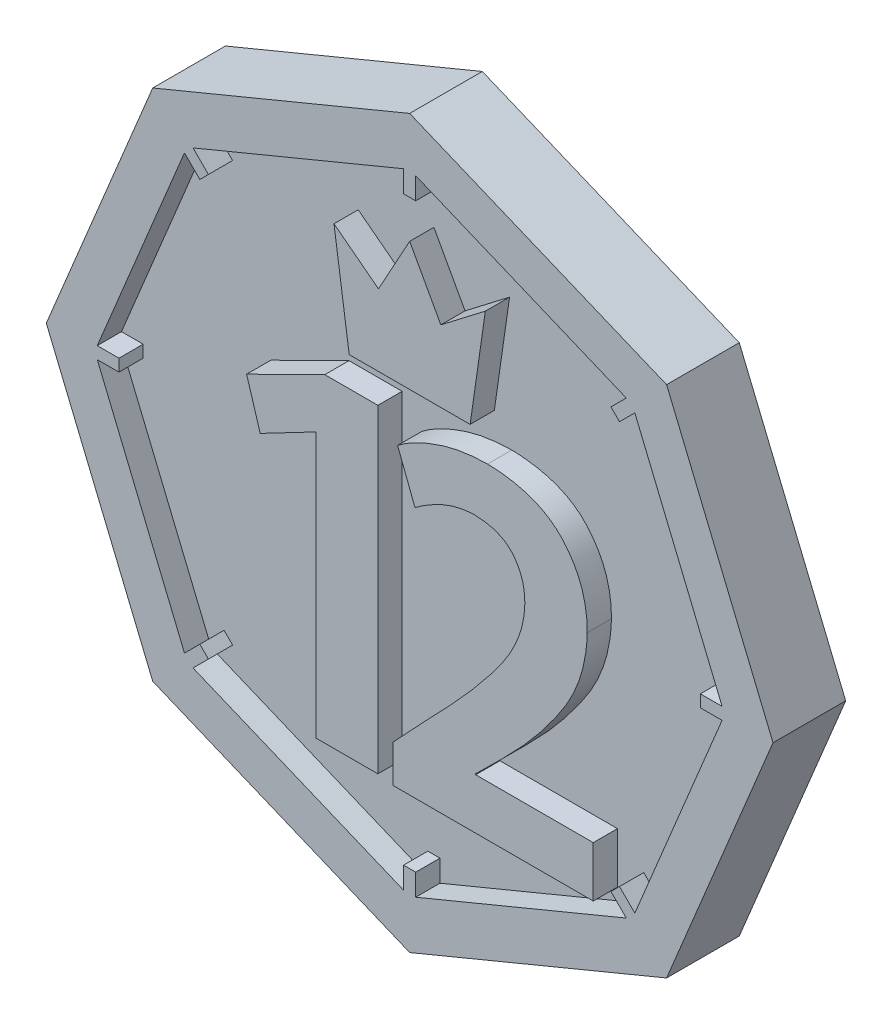
from build123d import *

# Parameters (mm, degrees)
BOSS_EXTRUDE2_DEPTH      = 2.54
BOSS_EXTRUDE3_DEPTH      = 5.08
BOSS_EXTRUDE3_DEPTH_BACK = 2.54
SKETCH2_W                = 1.27
SKETCH2_H                = 2.54
SKETCH2_W_2              = 2.54
SKETCH2_H_2              = 1.27
BOSS_EXTRUDE4_DEPTH      = 2.54
SKETCH4_W                = 46.629356418
SKETCH4_H                = 1.27
SKETCH4_W_2              = 1.27
SKETCH4_H_2              = 2.54
SKETCH4_W_3              = 2.54
BOSS_EXTRUDE5_DEPTH      = 1.27


with BuildPart() as part:
    # Sketch1 → Boss-Extrude2 (new body)
    with BuildSketch(Plane.XY):
        Polygon((33.02, 0), (23.348665915, 23.348665915), (0, 33.02), (-23.348665915, 23.348665915), (-33.02, 0), (-23.348665915, -23.348665915), (0, -33.02), (23.348665915, -23.348665915), align=None)
    extrude(amount=BOSS_EXTRUDE2_DEPTH)

    # Sketch1<3> → Boss-Extrude3 (add, two sides: drawn at the far end of the back side and taken through both)
    with BuildSketch(Plane.XY.offset(-BOSS_EXTRUDE3_DEPTH_BACK)):
        Polygon((-26.940768363, -26.940768363), (0, -38.1), (26.940768363, -26.940768363), (38.1, 0), (26.940768363, 26.940768363), (0, 38.1), (-26.940768363, 26.940768363), (-38.1, 0), align=None)
        Polygon((33.02, 0), (23.348665915, 23.348665915), (0, 33.02), (-23.348665915, 23.348665915), (-33.02, 0), (-23.348665915, -23.348665915), (0, -33.02), (23.348665915, -23.348665915), align=None, mode=Mode.SUBTRACT)
    extrude(amount=BOSS_EXTRUDE3_DEPTH + BOSS_EXTRUDE3_DEPTH_BACK)

    # Sketch2 → Boss-Extrude4 (add)
    with BuildSketch(Plane.XY.offset(2.54)):
        Polygon((-6.33928366, 13.03071018), (6.33928366, 13.03071018), (7.934955593, 24.113005041), (3.268356916, 20.533769163), (0, 26.484800243), (-3.268356916, 20.533769163), (-7.934955593, 24.113005041), align=None)
        Polygon((-23.797678721, -22.899653109), (-22.001627497, -21.103601885), (-21.103601885, -22.001627497), (-22.899653109, -23.797678721), align=None)
        with Locations((0, -31.75)):
            Rectangle(SKETCH2_W, SKETCH2_H)
        with Locations((-31.75, 0)):
            Rectangle(SKETCH2_W_2, SKETCH2_H_2)
        Polygon((-22.899653109, 23.797678721), (-21.103601885, 22.001627497), (-22.001627497, 21.103601885), (-23.797678721, 22.899653109), align=None)
        with Locations((0, 31.75)):
            Rectangle(SKETCH2_W, SKETCH2_H)
        Polygon((23.797678721, 22.899653109), (22.001627497, 21.103601885), (21.103601885, 22.001627497), (22.899653109, 23.797678721), align=None)
        with Locations((31.75, 0)):
            Rectangle(SKETCH2_W_2, SKETCH2_H_2)
        Polygon((22.899653109, -23.797678721), (21.103601885, -22.001627497), (22.001627497, -21.103601885), (23.797678721, -22.899653109), align=None)
        Polygon((-3.333537811, 9.927966113), (-8.900177124, 9.927966113), (-17.096018601, 5.871617863), (-15.671940782, 1.205489471), (-9.886624643, 4.231654837), (-9.797619779, 4.231654837), (-9.797619779, -23.537862633), (-3.333537811, -23.537862633), align=None)
        with BuildLine():
            Line((6.922689554, -18.493218361), (6.922689554, -18.403697928))
            Line((6.922689554, -18.403697928), (9.72634276, -15.628564506))
            add(Edge.make_bspline(
                [(9.72634276, -15.628564506), (10.332287944, -15.016473056), (11.524647172, -13.812019406), (13.172416474, -11.931158207), (14.660164159, -10.024941525), (15.798717524, -8.421067286), (16.598893506, -7.111608304), (17.116956203, -6.113359897), (17.560916159, -5.098439509), (17.930397338, -4.064084728), (18.220945847, -3.011778524), (18.433320957, -1.940167738), (18.570651911, -0.849044229), (18.603408202, -0.114308088), (18.619881518, 0.255194677)],
                knots=[0, 0, 0, 0, 1.659202022, 3.264923779, 4.814209511, 6.316896139, 7.051567576, 7.769144172, 8.482047353, 9.1843673, 9.883576409, 10.583408793, 11.287588645, 12, 12, 12, 12], degree=3))
            add(Edge.make_bspline(
                [(18.619881518, 0.255194677), (18.615435576, 0.601071076), (18.60668269, 1.282010333), (18.485887622, 2.281152902), (18.294922803, 3.240615682), (18.019974847, 4.156272636), (17.65383247, 5.024856703), (17.216597259, 5.851719306), (16.696514323, 6.636264444), (16.100524071, 7.376309607), (15.420064426, 8.058628564), (14.638104606, 8.644389658), (13.776230121, 9.15234777), (12.820652179, 9.56242342), (11.780481809, 9.889480517), (10.653245374, 10.131514076), (9.439093712, 10.295910385), (8.598098517, 10.327665773), (8.164035785, 10.344055677)],
                knots=[0, 0, 0, 0, 1.009543328, 1.987524111, 2.933968874, 3.863854154, 4.774078899, 5.682489326, 6.591612952, 7.518557726, 8.453666412, 9.397555261, 10.363899254, 11.368743061, 12.427215963, 13.543452787, 14.732102632, 16, 16, 16, 16], degree=3))
            add(Edge.make_bspline(
                [(8.164035785, 10.344055677), (7.684941919, 10.32797453), (6.743007697, 10.296357797), (5.362015599, 10.120943659), (4.041603429, 9.838122373), (2.794317739, 9.44973706), (1.626243466, 8.996697362), (0.559580653, 8.486492932), (-0.412669652, 7.947709555), (-0.988773246, 7.523656862), (-1.268115692, 7.31804121)],
                knots=[0, 0, 0, 0, 1.142131743, 2.245516072, 3.313064714, 4.356728811, 5.356075675, 6.296497493, 7.174001758, 8, 8, 8, 8], degree=3))
            Line((-1.268115692, 7.31804121), (0.5588418, 2.588843604))
            add(Edge.make_bspline(
                [(0.5588418, 2.588843604), (0.761624414, 2.73822703), (1.179666998, 3.046185549), (1.852748741, 3.473980759), (2.585276418, 3.878915966), (3.359619649, 4.265740791), (4.179369339, 4.595766629), (5.034966611, 4.842117606), (5.922117143, 5.001085019), (6.525905075, 5.030455546), (6.831301754, 5.045311195)],
                knots=[0, 0, 0, 0, 0.882381775, 1.819057125, 2.791981266, 3.814391476, 4.850565017, 5.88354078, 6.929492323, 8, 8, 8, 8], degree=3))
            add(Edge.make_bspline(
                [(6.831301754, 5.045311195), (7.05262941, 5.035997075), (7.481773548, 5.017937426), (8.102028287, 4.933140782), (8.675924907, 4.806874673), (9.20569981, 4.632281868), (9.687862888, 4.408049058), (10.124128937, 4.137236311), (10.508288932, 3.815406522), (10.962276839, 3.336981143), (11.414642606, 2.641825328), (11.816627167, 1.722978765), (12.043877023, 0.703922747), (12.066720546, -0.003373605), (12.078539606, -0.369323202)],
                knots=[0, 0, 0, 0, 0.93230204, 1.807690748, 2.631964675, 3.403485345, 4.151360469, 4.865902888, 5.558923755, 6.255646087, 7.636553115, 9.02477282, 10.460640741, 12, 12, 12, 12], degree=3))
            add(Edge.make_bspline(
                [(12.078539606, -0.369323202), (12.066738561, -0.650949198), (12.042933032, -1.219056121), (11.907439467, -2.071709448), (11.703715377, -2.935234471), (11.400711398, -3.804157577), (11.027577521, -4.686470876), (10.575049654, -5.577903391), (10.036648395, -6.475155054), (9.413096647, -7.383813144), (8.715042663, -8.315131115), (7.950934713, -9.282038165), (7.128727973, -10.294348765), (6.231878122, -11.342562384), (5.268348446, -12.430888512), (4.226503403, -13.548859259), (3.128783816, -14.715233752), (2.366408777, -15.498360209), (1.976801949, -15.898571914)],
                knots=[0, 0, 0, 0, 0.714042855, 1.440395043, 2.184640807, 2.96058558, 3.769988571, 4.611854656, 5.492656414, 6.420700846, 7.404361908, 8.442699269, 9.544774642, 10.710251598, 11.939640591, 13.229377797, 14.584091463, 16, 16, 16, 16], degree=3))
            Line((1.976801949, -15.898571914), (-1.755284656, -19.873409916))
            Line((-1.755284656, -19.873409916), (-1.755284656, -23.798401171))
            Line((-1.755284656, -23.798401171), (19.249347605, -23.798401171))
            Line((19.249347605, -23.798401171), (19.249347605, -18.493218361))
            Line((19.249347605, -18.493218361), (6.922689554, -18.493218361))
        make_face()
    extrude(amount=BOSS_EXTRUDE4_DEPTH)

    # Sketch4 → Boss-Extrude5 (add)
    # profile 1 of 22: a face of its own
    with BuildSketch(Plane(origin=(0, 0, 0), x_dir=(-1, 0, 0), z_dir=(0, 0, -1))):
        with Locations((0, 16.421907481)):
            Rectangle(SKETCH4_W, SKETCH4_H)
    # profile 2 of 22: a face of its own
    with BuildSketch(Plane(origin=(0, 0, 0), x_dir=(-1, 0, 0), z_dir=(0, 0, -1))):
        with Locations((0, -7.79874833)):
            Rectangle(SKETCH4_W, SKETCH4_H)
    # profile 3 of 22: a face of its own
    with BuildSketch(Plane(origin=(0, 0, 0), x_dir=(-1, 0, 0), z_dir=(0, 0, -1))):
        Polygon((-4.468926018, 18.824161798), (4.468926018, 18.824161798), (5.630987553, 27.738580238), (2.060469106, 23.703632944), (0, 27.682107512), (-2.060469106, 23.703632944), (-5.630987553, 27.738580238), align=None)
    # profile 4 of 22: a face of its own
    with BuildSketch(Plane(origin=(0, 0, 0), x_dir=(-1, 0, 0), z_dir=(0, 0, -1))):
        with Locations((0, -31.75)):
            Rectangle(SKETCH4_W_2, SKETCH4_H_2)
    # profile 5 of 22: a face of its own
    with BuildSketch(Plane(origin=(0, 0, 0), x_dir=(-1, 0, 0), z_dir=(0, 0, -1))):
        Polygon((-23.797678721, -22.899653109), (-22.001627497, -21.103601885), (-21.103601885, -22.001627497), (-22.899653109, -23.797678721), align=None)
    # profile 6 of 22: a face of its own
    with BuildSketch(Plane(origin=(0, 0, 0), x_dir=(-1, 0, 0), z_dir=(0, 0, -1))):
        with Locations((-31.75, 0)):
            Rectangle(SKETCH4_W_3, SKETCH4_H)
    # profile 7 of 22: a face of its own
    with BuildSketch(Plane(origin=(0, 0, 0), x_dir=(-1, 0, 0), z_dir=(0, 0, -1))):
        Polygon((-22.899653109, 23.797678721), (-21.103601885, 22.001627497), (-22.001627497, 21.103601885), (-23.797678721, 22.899653109), align=None)
    # profile 8 of 22: a face of its own
    with BuildSketch(Plane(origin=(0, 0, 0), x_dir=(-1, 0, 0), z_dir=(0, 0, -1))):
        with Locations((0, 31.75)):
            Rectangle(SKETCH4_W_2, SKETCH4_H_2)
    # profile 9 of 22: a face of its own
    with BuildSketch(Plane(origin=(0, 0, 0), x_dir=(-1, 0, 0), z_dir=(0, 0, -1))):
        Polygon((23.797678721, 22.899653109), (22.001627497, 21.103601885), (21.103601885, 22.001627497), (22.899653109, 23.797678721), align=None)
    # profile 10 of 22: a face of its own
    with BuildSketch(Plane(origin=(0, 0, 0), x_dir=(-1, 0, 0), z_dir=(0, 0, -1))):
        with Locations((31.75, 0)):
            Rectangle(SKETCH4_W_3, SKETCH4_H)
    # profile 11 of 22: a face of its own
    with BuildSketch(Plane(origin=(0, 0, 0), x_dir=(-1, 0, 0), z_dir=(0, 0, -1))):
        Polygon((22.899653109, -23.797678721), (21.103601885, -22.001627497), (22.001627497, -21.103601885), (23.797678721, -22.899653109), align=None)
    # profile 12 of 22: a face of its own
    with BuildSketch(Plane(origin=(0, 0, 0), x_dir=(-1, 0, 0), z_dir=(0, 0, -1))):
        with BuildLine():
            Line((-18.98935306, -1.77944746), (-18.98935306, 11.191145991))
            Line((-18.98935306, 11.191145991), (-21.217252955, 11.191145991))
            add(Edge.make_bspline(
                [(-21.217252955, 11.191145991), (-21.268482799, 11.189194693), (-21.367299755, 11.185430846), (-21.506094139, 11.144780414), (-21.62157244, 11.071347915), (-21.717007162, 10.971052384), (-21.789807118, 10.843331433), (-21.83861186, 10.686879818), (-21.872740438, 10.506484111), (-21.873867563, 10.375674968), (-21.874462757, 10.306599465)],
                knots=[0, 0, 0, 0, 0.977224629, 1.884963059, 2.724894201, 3.562760105, 4.506432734, 5.505399502, 6.682693129, 8, 8, 8, 8], degree=3))
            Line((-21.874462757, 10.306599465), (-21.874462757, 8.963246096))
            Line((-21.874462757, 8.963246096), (-24.788506219, 9.161649055))
            Line((-24.788506219, 9.161649055), (-24.788506219, 14.018388158))
            Line((-24.788506219, 14.018388158), (-9.846283362, 14.018388158))
            Line((-9.846283362, 14.018388158), (-9.846283362, 9.161649055))
            Line((-9.846283362, 9.161649055), (-12.760326824, 8.963246096))
            Line((-12.760326824, 8.963246096), (-12.760326824, 10.306599465))
            add(Edge.make_bspline(
                [(-12.760326824, 10.306599465), (-12.761262983, 10.381105346), (-12.76300524, 10.519765867), (-12.791577914, 10.710142017), (-12.83544146, 10.865225412), (-12.897444648, 10.993091857), (-13.004718014, 11.087539278), (-13.156501709, 11.152886172), (-13.358346852, 11.185261951), (-13.508381118, 11.189054204), (-13.591139215, 11.191145991)],
                knots=[0, 0, 0, 0, 1.236998566, 2.302138631, 3.185769551, 3.912918455, 4.625875948, 5.506834142, 6.624783066, 8, 8, 8, 8], degree=3))
            Line((-13.591139215, 11.191145991), (-15.533834856, 11.191145991))
            Line((-15.533834856, 11.191145991), (-15.533834856, -2.465591027))
            Line((-15.533834856, -2.465591027), (-13.277001196, -2.548258926))
            Line((-13.277001196, -2.548258926), (-13.277001196, -4.978695175))
            Line((-13.277001196, -4.978695175), (-21.332988015, -4.978695175))
            Line((-21.332988015, -4.978695175), (-21.332988015, -2.663993986))
            Line((-21.332988015, -2.663993986), (-19.820165451, -2.577192691))
            add(Edge.make_bspline(
                [(-19.820165451, -2.577192691), (-19.754986329, -2.569783262), (-19.630809871, -2.555667137), (-19.461026135, -2.501065793), (-19.31696119, -2.428834885), (-19.192161718, -2.343832728), (-19.10031648, -2.229135548), (-19.038238125, -2.095348105), (-18.994010236, -1.944800602), (-18.990954089, -1.836292018), (-18.98935306, -1.77944746)],
                knots=[0, 0, 0, 0, 1.218079664, 2.32063295, 3.295056221, 4.212876684, 5.105656009, 5.988443292, 6.946202713, 8, 8, 8, 8], degree=3))
        make_face()
    # profile 13 of 22: a face of its own
    with BuildSketch(Plane(origin=(0, 0, 0), x_dir=(-1, 0, 0), z_dir=(0, 0, -1))):
        with BuildLine():
            add(Edge.make_bspline(
                [(-0.361795238, 14.361459942), (-0.084499984, 14.35448915), (0.460012804, 14.340800905), (1.259792736, 14.227585089), (2.022924903, 14.035008602), (2.755542478, 13.776947961), (3.449560651, 13.433399732), (4.110171923, 13.017853686), (4.73611547, 12.52755466), (5.32520929, 11.964400208), (5.864274495, 11.325927202), (6.330637024, 10.601699714), (6.722348487, 9.798870837), (7.045384918, 8.9181461), (7.290408833, 7.957928091), (7.467058112, 6.919746982), (7.571117811, 5.803485865), (7.607679646, 4.63415947), (7.569587998, 3.463854378), (7.472420659, 2.341522542), (7.292952767, 1.294398577), (7.050253586, 0.319903528), (6.723602163, -0.577711351), (6.339259027, -1.406268533), (5.872274323, -2.155549173), (5.338067933, -2.826803767), (4.742908175, -3.421111479), (4.097907312, -3.939558379), (3.400513324, -4.378388753), (2.652272411, -4.734499465), (1.853714505, -5.011650861), (1.006186902, -5.21138284), (0.108477254, -5.322383911), (-0.820614326, -5.365199406), (-1.748267175, -5.322408769), (-2.642169518, -5.212237879), (-3.481685956, -5.010308788), (-4.273962691, -4.739879368), (-5.010794493, -4.38239059), (-5.697806555, -3.949275842), (-6.326393965, -3.431591829), (-6.909481339, -2.844436115), (-7.426010789, -2.176237869), (-7.874491608, -1.435450687), (-8.250837268, -0.622234548), (-8.560699322, 0.260806508), (-8.797853473, 1.216203666), (-8.970435103, 2.239932519), (-9.074935238, 3.335517316), (-9.085882475, 4.089736042), (-9.091525438, 4.478512542)],
                knots=[0, 0, 0, 0, 0.915382714, 1.797497739, 2.660384924, 3.510865206, 4.357295791, 5.211855023, 6.083726819, 6.978272765, 7.898650429, 8.836273308, 9.814952259, 10.84267508, 11.928501812, 13.082599651, 14.316669705, 15.627589643, 16.943056954, 18.181229506, 19.344295857, 20.447745948, 21.492566699, 22.493857774, 23.458369669, 24.400529174, 25.320603182, 26.230076371, 27.127556133, 28.035149761, 28.960327634, 29.913788544, 30.904721032, 31.943023514, 32.981325995, 33.967746822, 34.912352744, 35.827441454, 36.726833421, 37.610343502, 38.502804526, 39.410033182, 40.337367507, 41.284599284, 42.263616572, 43.290996949, 44.370159905, 45.510037374, 46.716501036, 48, 48, 48, 48], degree=3))
            add(Edge.make_bspline(
                [(-9.091525438, 4.478512542), (-9.089400016, 4.694898706), (-9.085227143, 5.119732784), (-9.044714154, 5.746821668), (-8.991125052, 6.354333957), (-8.901187461, 6.941102598), (-8.796032422, 7.508640679), (-8.662518052, 8.056090288), (-8.507444487, 8.583834456), (-8.324149688, 9.089385562), (-8.122011611, 9.56981609), (-7.908441547, 10.02651455), (-7.67621591, 10.451979903), (-7.431514769, 10.851248766), (-7.173599757, 11.223614167), (-6.893227803, 11.563854116), (-6.602139006, 11.879076139), (-6.392472591, 12.068892938), (-6.289083641, 12.162493812)],
                knots=[0, 0, 0, 0, 1.233193321, 2.421146243, 3.580805196, 4.708102709, 5.803208848, 6.869870998, 7.918455784, 8.936965639, 9.933128306, 10.888652697, 11.809366411, 12.694283943, 13.557039734, 14.388637188, 15.20541824, 16, 16, 16, 16], degree=3))
            add(Edge.make_bspline(
                [(-6.289083641, 12.162493812), (-6.075814052, 12.338715313), (-5.654749155, 12.686634997), (-4.975834833, 13.134391531), (-4.27053444, 13.510987977), (-3.541150698, 13.82371307), (-2.783495739, 14.063735996), (-2.00087324, 14.237337174), (-1.190052724, 14.344046541), (-0.640436643, 14.355601746), (-0.361795238, 14.361459942)],
                knots=[0, 0, 0, 0, 1.026688266, 2.027023128, 3.013499639, 3.992251704, 4.969491727, 5.959992852, 6.96576815, 8, 8, 8, 8], degree=3))
        make_face()
        with BuildLine():
            add(Edge.make_bspline(
                [(-5.520272175, 4.619047971), (-5.516251572, 4.332366315), (-5.508472319, 3.777680965), (-5.450450472, 2.974583749), (-5.355789385, 2.226616923), (-5.227078709, 1.532240161), (-5.053314818, 0.893883429), (-4.842853262, 0.309242116), (-4.592508215, -0.218459646), (-4.304538842, -0.693480233), (-3.978636049, -1.112663011), (-3.610783482, -1.477083503), (-3.203920711, -1.785221652), (-2.756419982, -2.034129083), (-2.273828336, -2.230612141), (-1.751056113, -2.36522189), (-1.191196905, -2.449304151), (-0.804378802, -2.460063709), (-0.605665542, -2.465591027)],
                knots=[0, 0, 0, 0, 1.404388501, 2.717277891, 3.942141577, 5.09651568, 6.173968345, 7.179706107, 8.136791145, 9.030486387, 9.896003801, 10.731277159, 11.56017147, 12.388213363, 13.233032392, 14.105679567, 15.026864082, 16, 16, 16, 16], degree=3))
            add(Edge.make_bspline(
                [(-0.605665542, -2.465591027), (-0.394345744, -2.460213012), (0.014487362, -2.449808353), (0.602865227, -2.342092388), (1.145519158, -2.177461726), (1.633758536, -1.930890942), (2.08131019, -1.630541701), (2.465761896, -1.2446203), (2.811009274, -0.800883497), (2.989769944, -0.463974345), (3.081322781, -0.291425267)],
                knots=[0, 0, 0, 0, 1.115810488, 2.15871997, 3.151471766, 4.102528743, 5.039878908, 5.987499782, 6.969291701, 8, 8, 8, 8], degree=3))
            add(Edge.make_bspline(
                [(3.081322781, -0.291425267), (3.159319358, -0.128450469), (3.31698068, 0.200984785), (3.515370013, 0.720213552), (3.67979254, 1.267814833), (3.815177421, 1.842192833), (3.923784368, 2.442142905), (3.996115433, 3.068988376), (4.042755465, 3.721395412), (4.04932706, 4.165670112), (4.052670602, 4.391711247)],
                knots=[0, 0, 0, 0, 0.898222309, 1.81565554, 2.760689363, 3.7395434, 4.748880663, 5.790807692, 6.875991952, 8, 8, 8, 8], degree=3))
            add(Edge.make_bspline(
                [(4.052670602, 4.391711247), (4.043069432, 4.798808846), (4.024211823, 5.598387187), (3.853951224, 6.77077381), (3.600894552, 7.898388595), (3.330874982, 8.610390145), (3.19705784, 8.963246096)],
                knots=[0, 0, 0, 0, 1.043411596, 2.049359458, 3.033295468, 4, 4, 4, 4], degree=3))
            add(Edge.make_bspline(
                [(3.19705784, 8.963246096), (3.109835918, 9.146577401), (2.938746011, 9.506190384), (2.596799091, 9.992419437), (2.194446591, 10.41793889), (1.723979103, 10.77673632), (1.191250395, 11.072726411), (0.578188642, 11.272737318), (-0.103078919, 11.394102059), (-0.71146907, 11.426789304), (-1.214805768, 11.408599967), (-1.587811626, 11.357143578), (-1.948314532, 11.280755681), (-2.294257732, 11.167630984), (-2.626340046, 11.022132397), (-2.945578673, 10.844768849), (-3.247694478, 10.631171585), (-3.63198478, 10.313115973), (-4.060374451, 9.861886845), (-4.503581107, 9.266965275), (-4.846544736, 8.609357481), (-5.107799891, 7.901281343), (-5.286266149, 7.143019639), (-5.425790156, 6.344262841), (-5.50228049, 5.496805141), (-5.514169232, 4.916791181), (-5.520272175, 4.619047971)],
                knots=[0, 0, 0, 0, 1.021933598, 2.004570844, 2.982188073, 3.962933528, 4.976192254, 6.039215585, 7.197152445, 8.456176752, 9.102690866, 9.733303575, 10.351790212, 10.95798781, 11.564463855, 12.176994324, 12.795480961, 13.426858141, 14.689249546, 15.921416898, 17.154836373, 18.414013926, 19.716131541, 21.076036175, 22.499018238, 24, 24, 24, 24], degree=3))
        make_face(mode=Mode.SUBTRACT)
    # profile 14 of 22: a face of its own
    with BuildSketch(Plane(origin=(0, 0, 0), x_dir=(-1, 0, 0), z_dir=(0, 0, -1))):
        with BuildLine():
            Line((24.040115372, 1.676070744), (24.040115372, -3.494806377))
            add(Edge.make_bspline(
                [(24.040115372, -3.494806377), (23.815513257, -3.642751425), (23.364823128, -3.939620281), (22.63390398, -4.303250085), (21.868405701, -4.620611141), (21.059623433, -4.873715489), (20.214045943, -5.079843395), (19.325985418, -5.216249853), (18.398533575, -5.303836026), (17.445921549, -5.331859296), (16.498835871, -5.30026016), (15.589538294, -5.185037934), (14.734255244, -4.992901835), (13.934131979, -4.717365575), (13.186777384, -4.369486649), (12.489093871, -3.94795193), (11.855158049, -3.435876166), (11.268081099, -2.857170228), (10.746296986, -2.198614105), (10.298243225, -1.460619711), (9.912444528, -0.654472189), (9.604717664, 0.23104807), (9.359105151, 1.187398422), (9.197605645, 2.220186187), (9.083356249, 3.324122979), (9.073860173, 4.085517089), (9.068958751, 4.478512542)],
                knots=[0, 0, 0, 0, 0.89485755, 1.795635202, 2.713256254, 3.652058756, 4.614641704, 5.608798745, 6.641027956, 7.715111432, 8.780339177, 9.793300775, 10.762726094, 11.694224118, 12.605572594, 13.503389213, 14.401205832, 15.312842985, 16.243628894, 17.191035791, 18.18224529, 19.213984954, 20.307847166, 21.465654487, 22.691891298, 24, 24, 24, 24], degree=3))
            add(Edge.make_bspline(
                [(9.068958751, 4.478512542), (9.07410841, 4.827424542), (9.084149023, 5.507720153), (9.197191553, 6.500717873), (9.366485278, 7.441550733), (9.610091613, 8.324666121), (9.913462554, 9.141852939), (10.251843213, 9.891233382), (10.639263253, 10.564239743), (11.071233878, 11.164620903), (11.550719916, 11.698350898), (12.051809645, 12.195697025), (12.601900648, 12.634076628), (12.991004301, 12.89273518), (13.185820152, 13.022239968)],
                knots=[0, 0, 0, 0, 1.264731503, 2.465926336, 3.619368682, 4.72849992, 5.782891146, 6.777797955, 7.706786795, 8.594298836, 9.45445623, 10.305979455, 11.151840258, 12, 12, 12, 12], degree=3))
            add(Edge.make_bspline(
                [(13.185820152, 13.022239968), (13.378710404, 13.129589128), (13.763450615, 13.343708493), (14.365279136, 13.617697441), (14.987448572, 13.84219056), (15.624911353, 14.036619993), (16.285129611, 14.177613562), (16.96207887, 14.287832782), (17.659751782, 14.348173471), (18.370390217, 14.36697859), (19.08532296, 14.352931597), (19.792746535, 14.292333919), (20.489728977, 14.202673278), (21.174492886, 14.075443871), (21.845636612, 13.907995937), (22.506433695, 13.710636171), (23.153339939, 13.471704039), (23.573988284, 13.284902361), (23.783844884, 13.191709162)],
                knots=[0, 0, 0, 0, 0.962951813, 1.920710241, 2.881181764, 3.847412023, 4.826166394, 5.824408197, 6.838401579, 7.878870305, 8.925192871, 9.956643373, 10.975242001, 11.990446504, 12.993600091, 13.992077199, 14.998270516, 16, 16, 16, 16], degree=3))
            Line((23.783844884, 13.191709162), (23.783844884, 8.334970059))
            Line((23.783844884, 8.334970059), (20.869801422, 8.1365671))
            Line((20.869801422, 8.1365671), (20.869801422, 10.364466995))
            add(Edge.make_bspline(
                [(20.869801422, 10.364466995), (20.867939332, 10.430643033), (20.86443783, 10.555081425), (20.846404784, 10.727352073), (20.809803748, 10.872410794), (20.771735277, 10.95459736), (20.754066362, 10.992743032)],
                knots=[0, 0, 0, 0, 1.232055725, 2.316775653, 3.218756464, 4, 4, 4, 4], degree=3))
            add(Edge.make_bspline(
                [(20.754066362, 10.992743032), (20.720824701, 11.03829844), (20.646999186, 11.139471228), (20.45951152, 11.238381612), (20.22779159, 11.336514842), (19.929241226, 11.404166727), (19.574108814, 11.468268143), (19.155042971, 11.505253968), (18.675301334, 11.530412893), (18.334700183, 11.532899645), (18.154160919, 11.534217774)],
                knots=[0, 0, 0, 0, 0.490716836, 1.089819888, 1.824069302, 2.712434388, 3.771231139, 5.002197861, 6.410983076, 8, 8, 8, 8], degree=3))
            add(Edge.make_bspline(
                [(18.154160919, 11.534217774), (17.930655711, 11.530569888), (17.497146138, 11.523494465), (16.870601431, 11.437248917), (16.285858589, 11.306351918), (15.743456798, 11.122858507), (15.245030057, 10.878794065), (14.787866824, 10.585853573), (14.374718721, 10.235733251), (14.009472196, 9.8283583), (13.680850573, 9.374723081), (13.403907673, 8.861254269), (13.164430476, 8.300015376), (12.969650041, 7.682637046), (12.824170312, 7.012511736), (12.717798565, 6.290301824), (12.64996367, 5.515910761), (12.643531023, 4.981556398), (12.640212014, 4.705849266)],
                knots=[0, 0, 0, 0, 1.068258036, 2.071987886, 3.018333858, 3.931091984, 4.80344547, 5.666188711, 6.521754935, 7.384800116, 8.277231826, 9.194427351, 10.168718072, 11.191985408, 12.285552558, 13.444884619, 14.681654752, 16, 16, 16, 16], degree=3))
            add(Edge.make_bspline(
                [(12.640212014, 4.705849266), (12.644159199, 4.415021874), (12.651799928, 3.852055291), (12.710987629, 3.035403802), (12.802196384, 2.274158995), (12.939884935, 1.568951415), (13.109834102, 0.917866966), (13.325707642, 0.324994122), (13.575652342, -0.213457229), (13.873435512, -0.691930029), (14.200898819, -1.120807861), (14.574707272, -1.489299027), (14.9853686, -1.801752431), (15.437039905, -2.054739847), (15.924879493, -2.255939), (16.453113711, -2.394618883), (17.020316666, -2.478241688), (17.411230454, -2.48898716), (17.612686177, -2.494524792)],
                knots=[0, 0, 0, 0, 1.404093699, 2.717962122, 3.951567485, 5.103621193, 6.184807657, 7.197075335, 8.14637199, 9.0454833, 9.913106436, 10.745745791, 11.572008966, 12.397173369, 13.238484631, 14.113118772, 15.027603957, 16, 16, 16, 16], degree=3))
            add(Edge.make_bspline(
                [(17.612686177, -2.494524792), (17.772544377, -2.491515442), (18.082873283, -2.485673464), (18.53430368, -2.458655938), (18.95712933, -2.40610037), (19.349691755, -2.325729409), (19.715212458, -2.232746172), (20.052936153, -2.116461436), (20.36309013, -1.979037904), (20.551231655, -1.864111165), (20.642464698, -1.808381225)],
                knots=[0, 0, 0, 0, 1.219055175, 2.366522706, 3.446760331, 4.464555673, 5.420101886, 6.32046166, 7.185563142, 8, 8, 8, 8], degree=3))
            Line((20.642464698, -1.808381225), (20.642464698, 2.449015606))
            Line((20.642464698, 2.449015606), (20.613530933, 2.449015606))
            Line((20.613530933, 2.449015606), (18.414564803, 2.535816901))
            Line((18.414564803, 2.535816901), (18.414564803, 4.962119754))
            Line((18.414564803, 4.962119754), (25.528137566, 4.962119754))
            Line((25.528137566, 4.962119754), (25.528137566, 2.67635233))
            Line((25.528137566, 2.67635233), (24.870927764, 2.622618195))
            add(Edge.make_bspline(
                [(24.870927764, 2.622618195), (24.800240634, 2.612098538), (24.668237825, 2.592453884), (24.489841195, 2.53748958), (24.339717513, 2.474174508), (24.222113792, 2.383973537), (24.131615369, 2.262485873), (24.078391124, 2.101307516), (24.046343588, 1.901972339), (24.042323253, 1.756152066), (24.040115372, 1.676070744)],
                knots=[0, 0, 0, 0, 1.186267568, 2.215263958, 3.096781176, 3.880294166, 4.649956514, 5.577587387, 6.669663702, 8, 8, 8, 8], degree=3))
        make_face()
    # profile 15 of 22: a face of its own
    with BuildSketch(Plane(origin=(0, 0, 0), x_dir=(-1, 0, 0), z_dir=(0, 0, -1))):
        with BuildLine():
            add(Edge.make_bspline(
                [(-17.255883649, -14.075309535), (-17.266733587, -14.059886695), (-17.290353518, -14.026311719), (-17.349364532, -13.992143227), (-17.421521888, -13.958430065), (-17.513832859, -13.935764325), (-17.622319594, -13.913649343), (-17.749868555, -13.901023921), (-17.895195374, -13.892547812), (-17.998361665, -13.891670417), (-18.052719534, -13.891208122)],
                knots=[0, 0, 0, 0, 0.531632017, 1.157344134, 1.904191246, 2.804553967, 3.851774823, 5.060608256, 6.451247335, 8, 8, 8, 8], degree=3))
            add(Edge.make_bspline(
                [(-18.052719534, -13.891208122), (-18.125892962, -13.893095562), (-18.268119295, -13.896764156), (-18.4749122, -13.925247951), (-18.668062678, -13.972092219), (-18.846962234, -14.040640055), (-19.012952919, -14.126654885), (-19.165818394, -14.232092451), (-19.302748043, -14.359273887), (-19.427158716, -14.503197946), (-19.536884345, -14.665528332), (-19.631005592, -14.845500104), (-19.710979329, -15.041830588), (-19.777173352, -15.254722073), (-19.827006983, -15.484805009), (-19.863121213, -15.731766865), (-19.886122574, -15.995524913), (-19.888365897, -16.177201916), (-19.889517595, -16.270472941)],
                knots=[0, 0, 0, 0, 1.027425039, 1.996993952, 2.925720651, 3.812847462, 4.680984233, 5.546098955, 6.412238858, 7.298584576, 8.21284234, 9.157581752, 10.146031387, 11.186539837, 12.284833024, 13.448872937, 14.690278722, 16, 16, 16, 16], degree=3))
            add(Edge.make_bspline(
                [(-19.889517595, -16.270472941), (-19.888268209, -16.367483784), (-19.885850764, -16.555190662), (-19.864494431, -16.827363858), (-19.82998907, -17.080928474), (-19.781105226, -17.316335397), (-19.718535733, -17.533317316), (-19.641061598, -17.731468895), (-19.550143842, -17.910960896), (-19.444005224, -18.071322857), (-19.323856259, -18.213021611), (-19.189831379, -18.336582984), (-19.040730821, -18.439408612), (-18.878670867, -18.524913676), (-18.702090921, -18.59105629), (-18.510866319, -18.636634463), (-18.306079795, -18.665326445), (-18.164778516, -18.668952318), (-18.092069454, -18.670818075)],
                knots=[0, 0, 0, 0, 1.361698404, 2.634758638, 3.829861646, 4.95197018, 6.007077495, 6.996264085, 7.934492997, 8.826405018, 9.689509838, 10.536658188, 11.377658048, 12.224857448, 13.103087527, 14.017032482, 14.979629123, 16, 16, 16, 16], degree=3))
            add(Edge.make_bspline(
                [(-18.092069454, -18.670818075), (-18.083168859, -18.670817583), (-18.056935528, -18.670816132), (-18.004938211, -18.670838677), (-17.928106787, -18.67068522), (-17.793991613, -18.671823341), (-17.613665223, -18.662066391), (-17.438740045, -18.62174462), (-17.316019158, -18.578404262), (-17.244160077, -18.547465828), (-17.19199762, -18.515594769), (-17.158200513, -18.478882437), (-17.141856201, -18.435131336), (-17.129039929, -18.386244696), (-17.122670083, -18.327119634), (-17.121567915, -18.284820679), (-17.120969637, -18.261859975)],
                knots=[0, 0, 0, 0, 0.312638408, 0.92146057, 1.826466487, 3.011201505, 5.633744911, 8.148509054, 9.28304515, 10.203623799, 10.892757555, 11.417503638, 11.918763254, 12.51341174, 13.193050662, 14, 14, 14, 14], degree=3))
            Line((-17.120969637, -18.261859975), (-17.120969637, -17.484699051))
            Line((-17.120969637, -17.484699051), (-16.13019486, -17.553561411))
            Line((-16.13019486, -17.553561411), (-16.13019486, -19.232959792))
            add(Edge.make_bspline(
                [(-16.13019486, -19.232959792), (-16.194761688, -19.265579908), (-16.326081955, -19.331924848), (-16.536585032, -19.409701971), (-16.757634326, -19.479601857), (-16.992029921, -19.535472745), (-17.239376003, -19.578900444), (-17.499389974, -19.608733552), (-17.771769127, -19.629886387), (-17.957580535, -19.631337443), (-18.052719534, -19.632080412)],
                knots=[0, 0, 0, 0, 0.875107143, 1.779850544, 2.712600346, 3.680979655, 4.694490943, 5.751071419, 6.848505513, 8, 8, 8, 8], degree=3))
            add(Edge.make_bspline(
                [(-18.052719534, -19.632080412), (-18.173222734, -19.62989774), (-18.407417409, -19.625655779), (-18.747482826, -19.585825097), (-19.065448717, -19.519992801), (-19.361792017, -19.429000849), (-19.636661972, -19.312473229), (-19.888987079, -19.167997346), (-20.119078766, -18.997114758), (-20.32761172, -18.800727376), (-20.510929201, -18.576840455), (-20.670340357, -18.3276423), (-20.805813679, -18.053436888), (-20.914718868, -17.753382439), (-21.000836662, -17.42847001), (-21.059485319, -17.077934632), (-21.096868186, -16.702256977), (-21.101402955, -16.443425913), (-21.103743705, -16.309822861)],
                knots=[0, 0, 0, 0, 1.121093534, 2.178814616, 3.18088755, 4.139247195, 5.059155523, 5.953534805, 6.838536075, 7.720525664, 8.612521746, 9.524336882, 10.467977559, 11.452774883, 12.490139317, 13.591737059, 14.756906246, 16, 16, 16, 16], degree=3))
            add(Edge.make_bspline(
                [(-21.103743705, -16.309822861), (-21.103004998, -16.234847617), (-21.10154959, -16.087130554), (-21.087955182, -15.869692829), (-21.069589485, -15.659406507), (-21.039034894, -15.457090671), (-21.0032412, -15.261333999), (-20.958090737, -15.072794096), (-20.905156943, -14.89153586), (-20.84274721, -14.718290026), (-20.774364664, -14.553161278), (-20.70002527, -14.396798531), (-20.619378484, -14.250206295), (-20.534703773, -14.112355788), (-20.441672368, -13.98532422), (-20.346172923, -13.86521357), (-20.241257033, -13.757162153), (-20.167672915, -13.690785161), (-20.131238534, -13.657919309)],
                knots=[0, 0, 0, 0, 1.235980129, 2.435141844, 3.591014803, 4.714965851, 5.807154358, 6.871207412, 7.909869871, 8.918816805, 9.905645509, 10.855669653, 11.771647661, 12.66320399, 13.52065367, 14.366229023, 15.191055936, 16, 16, 16, 16], degree=3))
            add(Edge.make_bspline(
                [(-20.131238534, -13.657919309), (-20.05771974, -13.599913537), (-19.911419715, -13.484483922), (-19.676107829, -13.335761004), (-19.430344481, -13.210288273), (-19.175252237, -13.106751004), (-18.908996979, -13.028559113), (-18.633335604, -12.970426392), (-18.346364542, -12.936243634), (-18.151653525, -12.932067637), (-18.052719534, -12.929945785)],
                knots=[0, 0, 0, 0, 0.998910034, 1.987798715, 2.964889366, 3.940610512, 4.921314096, 5.922411121, 6.94436297, 8, 8, 8, 8], degree=3))
            add(Edge.make_bspline(
                [(-18.052719534, -12.929945785), (-17.972566322, -12.930753205), (-17.812947758, -12.932361116), (-17.575249943, -12.953725075), (-17.341008872, -12.983578104), (-17.110649421, -13.027553327), (-16.884346591, -13.08434542), (-16.660432063, -13.150915842), (-16.441190054, -13.23279189), (-16.298534086, -13.296025646), (-16.227164306, -13.32766105)],
                knots=[0, 0, 0, 0, 1.021149204, 2.033535123, 3.039138994, 4.029691299, 5.020081677, 6.011622962, 7.005228931, 8, 8, 8, 8], degree=3))
            Line((-16.227164306, -13.32766105), (-16.227164306, -14.978952345))
            Line((-16.227164306, -14.978952345), (-17.217939083, -15.046409352))
            Line((-17.217939083, -15.046409352), (-17.217939083, -14.288923387))
            add(Edge.make_bspline(
                [(-17.217939083, -14.288923387), (-17.218509173, -14.266407757), (-17.219581179, -14.224069036), (-17.226463234, -14.165801123), (-17.236602884, -14.11602433), (-17.249756126, -14.088248898), (-17.255883649, -14.075309535)],
                knots=[0, 0, 0, 0, 1.23397436, 2.320383484, 3.217539862, 4, 4, 4, 4], degree=3))
        make_face()
    # profile 16 of 22: a face of its own
    with BuildSketch(Plane(origin=(0, 0, 0), x_dir=(-1, 0, 0), z_dir=(0, 0, -1))):
        with BuildLine():
            Line((-14.731867338, -18.417854302), (-14.731867338, -13.68743175))
            add(Edge.make_bspline(
                [(-14.731867338, -13.68743175), (-14.732232709, -13.663509274), (-14.732909953, -13.619167051), (-14.741916009, -13.558811092), (-14.758564723, -13.510167301), (-14.783549968, -13.472523734), (-14.817902354, -13.444566078), (-14.861672899, -13.425408002), (-14.914749946, -13.411265161), (-14.953812774, -13.407173914), (-14.974993631, -13.404955537)],
                knots=[0, 0, 0, 0, 1.331676089, 2.468368191, 3.384538633, 4.17334033, 4.951716876, 5.815490653, 6.81550363, 8, 8, 8, 8], degree=3))
            Line((-14.974993631, -13.404955537), (-15.31508937, -13.385280577))
            Line((-15.31508937, -13.385280577), (-15.31508937, -12.580012566))
            Line((-15.31508937, -12.580012566), (-13.586503588, -12.580012566))
            Line((-13.586503588, -12.580012566), (-13.586503588, -15.192566198))
            add(Edge.make_bspline(
                [(-13.586503588, -15.192566198), (-13.543233863, -15.135337804), (-13.458582777, -15.023378561), (-13.312710799, -14.875286726), (-13.152179982, -14.752981717), (-12.980849794, -14.649796245), (-12.795266456, -14.571105809), (-12.597440064, -14.515199687), (-12.387087971, -14.480366001), (-12.242655385, -14.476443854), (-12.168501106, -14.474430154)],
                knots=[0, 0, 0, 0, 1.038484631, 2.031647991, 2.999289289, 3.954648889, 4.921314346, 5.909248965, 6.926570943, 8, 8, 8, 8], degree=3))
            add(Edge.make_bspline(
                [(-12.168501106, -14.474430154), (-12.108479035, -14.475783981), (-11.991847786, -14.478414656), (-11.822182322, -14.498647481), (-11.662886217, -14.530082634), (-11.513877003, -14.576576762), (-11.376099785, -14.637826085), (-11.246799287, -14.708872542), (-11.129301523, -14.795440586), (-11.023540111, -14.895888657), (-10.928992663, -15.009188881), (-10.845399977, -15.134436867), (-10.776266512, -15.273964342), (-10.720639958, -15.426924885), (-10.675283357, -15.592228367), (-10.645649666, -15.771211903), (-10.624709775, -15.9626711), (-10.623326075, -16.095209078), (-10.622611383, -16.163666015)],
                knots=[0, 0, 0, 0, 1.101489928, 2.140348435, 3.131939574, 4.078358154, 4.998593909, 5.895596781, 6.781318237, 7.669374052, 8.566665383, 9.484849955, 10.427001046, 11.417323736, 12.468634274, 13.568478357, 14.744099421, 16, 16, 16, 16], degree=3))
            Line((-10.622611383, -16.163666015), (-10.622611383, -18.698925161))
            Line((-10.622611383, -18.698925161), (-10.070307146, -18.728437601))
            Line((-10.070307146, -18.728437601), (-10.070307146, -19.505598525))
            Line((-10.070307146, -19.505598525), (-12.382114959, -19.505598525))
            Line((-12.382114959, -19.505598525), (-12.382114959, -18.767787521))
            Line((-12.382114959, -18.767787521), (-12.060288826, -18.738275081))
            add(Edge.make_bspline(
                [(-12.060288826, -18.738275081), (-12.037646286, -18.734701011), (-11.995061833, -18.72797916), (-11.936996859, -18.708774063), (-11.886636205, -18.687904537), (-11.8466719, -18.656760194), (-11.814709621, -18.615833769), (-11.793157654, -18.56153189), (-11.781140183, -18.493802867), (-11.779895189, -18.444611994), (-11.779217967, -18.417854302)],
                knots=[0, 0, 0, 0, 1.13274744, 2.130389526, 3.023009143, 3.816390203, 4.609771263, 5.566113547, 6.676071785, 8, 8, 8, 8], degree=3))
            Line((-11.779217967, -18.417854302), (-11.779217967, -16.416629788))
            add(Edge.make_bspline(
                [(-11.779217967, -16.416629788), (-11.780936747, -16.337382051), (-11.784184568, -16.187634929), (-11.812451617, -15.976795558), (-11.862779106, -15.795197351), (-11.920823783, -15.662615119), (-11.983110636, -15.575279134), (-12.036354279, -15.517288546), (-12.102793735, -15.471924041), (-12.175652173, -15.431636999), (-12.259282494, -15.402231591), (-12.351776345, -15.381752082), (-12.453902678, -15.369229772), (-12.562458658, -15.365644373), (-12.672992692, -15.369019947), (-12.780147982, -15.383463798), (-12.881397951, -15.405534297), (-12.977099967, -15.436797015), (-13.066742648, -15.477201012), (-13.150446375, -15.527562107), (-13.229881094, -15.584446348), (-13.323507679, -15.674460115), (-13.425405948, -15.799045732), (-13.513390951, -15.968782272), (-13.568048171, -16.154245073), (-13.573749795, -16.283209161), (-13.576666108, -16.349172782)],
                knots=[0, 0, 0, 0, 1.842534757, 3.481667603, 4.930098868, 6.216653691, 6.81815347, 7.419159852, 8.035855349, 8.679201932, 9.351147495, 10.088435054, 10.878851464, 11.740037082, 12.612108185, 13.447129678, 14.250574784, 15.01876008, 15.784159843, 16.531438746, 17.287479285, 18.050394482, 19.545785718, 21.007469146, 22.469355514, 24, 24, 24, 24], degree=3))
            Line((-13.576666108, -16.349172782), (-13.576666108, -18.698925161))
            Line((-13.576666108, -18.698925161), (-13.022956517, -18.728437601))
            Line((-13.022956517, -18.728437601), (-13.022956517, -19.505598525))
            Line((-13.022956517, -19.505598525), (-15.33476433, -19.505598525))
            Line((-15.33476433, -19.505598525), (-15.33476433, -18.767787521))
            Line((-15.33476433, -18.767787521), (-15.014343551, -18.738275081))
            add(Edge.make_bspline(
                [(-15.014343551, -18.738275081), (-14.991223506, -18.734743923), (-14.948142859, -18.728164153), (-14.889647651, -18.708765132), (-14.839285258, -18.687906535), (-14.799321351, -18.656759689), (-14.767358966, -18.615833935), (-14.745807033, -18.561531835), (-14.733789551, -18.493802886), (-14.732544559, -18.444612001), (-14.731867338, -18.417854302)],
                knots=[0, 0, 0, 0, 1.152268046, 2.147074271, 3.037156559, 3.828282382, 4.619408206, 5.573032026, 6.679835136, 8, 8, 8, 8], degree=3))
        make_face()
    # profile 17 of 22: a face of its own
    with BuildSketch(Plane(origin=(0, 0, 0), x_dir=(-1, 0, 0), z_dir=(0, 0, -1))):
        with BuildLine():
            Line((-5.116433261, -14.814525893), (-5.116433261, -18.427691782))
            add(Edge.make_bspline(
                [(-5.116433261, -18.427691782), (-5.116399642, -18.45168373), (-5.116337861, -18.495773535), (-5.103614409, -18.555249244), (-5.09038993, -18.60478435), (-5.0650483, -18.642641617), (-5.029903395, -18.668955944), (-4.98670187, -18.688418554), (-4.93397502, -18.702275902), (-4.895411163, -18.706497), (-4.874712323, -18.708762641)],
                knots=[0, 0, 0, 0, 1.3395734, 2.461722969, 3.399626347, 4.193105917, 4.959650055, 5.828546316, 6.834489725, 8, 8, 8, 8], degree=3))
            Line((-4.874712323, -18.708762641), (-4.562723669, -18.728437601))
            Line((-4.562723669, -18.728437601), (-4.562723669, -19.505598525))
            Line((-4.562723669, -19.505598525), (-6.107208038, -19.505598525))
            Line((-6.107208038, -19.505598525), (-6.107208038, -18.942051453))
            Line((-6.107208038, -18.942051453), (-6.136720478, -18.932213973))
            add(Edge.make_bspline(
                [(-6.136720478, -18.932213973), (-6.177501367, -18.988166239), (-6.257355074, -19.097727262), (-6.39807745, -19.239455096), (-6.548289597, -19.361276819), (-6.710880208, -19.459475574), (-6.883660106, -19.538123801), (-7.068511534, -19.592980201), (-7.264533499, -19.625522336), (-7.399072775, -19.629867503), (-7.467590994, -19.632080412)],
                knots=[0, 0, 0, 0, 1.057956131, 2.071600755, 3.045416118, 4.010328807, 4.969474715, 5.942234508, 6.952020323, 8, 8, 8, 8], degree=3))
            add(Edge.make_bspline(
                [(-7.467590994, -19.632080412), (-7.547793063, -19.630322513), (-7.703153656, -19.626917262), (-7.92774029, -19.597028993), (-8.136107794, -19.54821876), (-8.328632178, -19.479172112), (-8.506311899, -19.390511234), (-8.666871059, -19.280066982), (-8.812053255, -19.151276951), (-8.9390082, -19.002026752), (-9.049290899, -18.83543974), (-9.146391549, -18.654701559), (-9.230353088, -18.460055373), (-9.295151063, -18.249508194), (-9.347169567, -18.025476105), (-9.385020113, -17.786973289), (-9.407696667, -17.533862852), (-9.410010085, -17.360138986), (-9.411195982, -17.271085198)],
                knots=[0, 0, 0, 0, 1.104510341, 2.139563052, 3.114779682, 4.047716154, 4.95109861, 5.842553323, 6.724732194, 7.617237532, 8.533688456, 9.47214452, 10.440740138, 11.449049943, 12.502608568, 13.607118909, 14.77336874, 16, 16, 16, 16], degree=3))
            add(Edge.make_bspline(
                [(-9.411195982, -17.271085198), (-9.409624095, -17.163715174), (-9.406569406, -16.955060169), (-9.373809464, -16.651434822), (-9.326780774, -16.365681508), (-9.255493843, -16.0983882), (-9.166500106, -15.848336306), (-9.054974309, -15.617516097), (-8.92484633, -15.40413312), (-8.774585246, -15.209866537), (-8.603648335, -15.035328463), (-8.411412997, -14.884157726), (-8.198478631, -14.757253252), (-7.966650639, -14.652612551), (-7.714554638, -14.573004863), (-7.442979362, -14.51590231), (-7.151408097, -14.480016056), (-6.950060225, -14.476328287), (-6.846424396, -14.474430154)],
                knots=[0, 0, 0, 0, 1.1898244, 2.312217193, 3.382014673, 4.397317528, 5.374778699, 6.32014731, 7.233993518, 8.140862737, 9.036916363, 9.935599812, 10.844058741, 11.778451255, 12.74910096, 13.768698102, 14.851525872, 16, 16, 16, 16], degree=3))
            add(Edge.make_bspline(
                [(-6.846424396, -14.474430154), (-6.777069554, -14.475648952), (-6.637726796, -14.478097673), (-6.427067479, -14.493824168), (-6.214317367, -14.521082208), (-5.998639918, -14.556506048), (-5.781831764, -14.607780435), (-5.56139504, -14.664062613), (-5.338686523, -14.733254996), (-5.19116686, -14.78719821), (-5.116433261, -14.814525893)],
                knots=[0, 0, 0, 0, 0.939055392, 1.886682527, 2.858268453, 3.842606476, 4.844283857, 5.873475771, 6.922700849, 8, 8, 8, 8], degree=3))
        make_face()
        with BuildLine():
            Line((-6.243527404, -17.961114156), (-6.243527404, -15.445529971))
            add(Edge.make_bspline(
                [(-6.243527404, -15.445529971), (-6.292776407, -15.426022822), (-6.397552948, -15.384521644), (-6.573448257, -15.345137562), (-6.774218859, -15.324068899), (-6.916168844, -15.320783896), (-6.991175889, -15.319048084)],
                knots=[0, 0, 0, 0, 0.831555892, 1.769123137, 2.821194105, 4, 4, 4, 4], degree=3))
            add(Edge.make_bspline(
                [(-6.991175889, -15.319048084), (-7.043733113, -15.320689504), (-7.145670371, -15.323873116), (-7.293105013, -15.34780368), (-7.429416178, -15.388450574), (-7.554513337, -15.446519059), (-7.667717316, -15.521425752), (-7.768992898, -15.613300179), (-7.85916437, -15.720678691), (-7.937581474, -15.844148555), (-8.005910651, -15.980545704), (-8.064724733, -16.128304485), (-8.113788307, -16.286810544), (-8.154087122, -16.455409543), (-8.186905324, -16.634531611), (-8.208394948, -16.824706589), (-8.223215334, -17.025380978), (-8.224447067, -17.162843988), (-8.225076958, -17.233140632)],
                knots=[0, 0, 0, 0, 0.980515859, 1.901757549, 2.778452544, 3.627154066, 4.466074048, 5.301708071, 6.170302172, 7.074800228, 8.024834452, 9.013461744, 10.039268375, 11.11851583, 12.246818799, 13.435258183, 14.688427197, 16, 16, 16, 16], degree=3))
            add(Edge.make_bspline(
                [(-8.225076958, -17.233140632), (-8.22420127, -17.296865907), (-8.222512845, -17.419735269), (-8.211475963, -17.598012578), (-8.192126157, -17.764171643), (-8.164209644, -17.918086527), (-8.129297539, -18.060112), (-8.086176584, -18.189638761), (-8.034174822, -18.306749609), (-7.974635875, -18.411528357), (-7.909084426, -18.505924574), (-7.832491201, -18.585925205), (-7.749128748, -18.654259988), (-7.657389649, -18.710100766), (-7.557986772, -18.7531521), (-7.450463547, -18.784713047), (-7.335181429, -18.802946253), (-7.25544749, -18.804788789), (-7.214627221, -18.805732087)],
                knots=[0, 0, 0, 0, 1.445875801, 2.787808091, 4.050809377, 5.239151388, 6.334748589, 7.366623668, 8.332505247, 9.236895197, 10.098094778, 10.932645976, 11.741067981, 12.537664962, 13.361109665, 14.191861878, 15.074312846, 16, 16, 16, 16], degree=3))
            add(Edge.make_bspline(
                [(-7.214627221, -18.805732087), (-7.146335651, -18.803319402), (-7.014365027, -18.798656989), (-6.82686613, -18.746803989), (-6.657439698, -18.667207633), (-6.513658176, -18.553108688), (-6.395196691, -18.421791624), (-6.306401101, -18.277623074), (-6.253139418, -18.122135194), (-6.246738766, -18.014911083), (-6.243527404, -17.961114156)],
                knots=[0, 0, 0, 0, 1.144545625, 2.211786926, 3.243222439, 4.269721098, 5.273055442, 6.201743391, 7.097771216, 8, 8, 8, 8], degree=3))
        make_face(mode=Mode.SUBTRACT)
    # profile 18 of 22: a face of its own
    with BuildSketch(Plane(origin=(0, 0, 0), x_dir=(-1, 0, 0), z_dir=(0, 0, -1))):
        with BuildLine():
            Line((-3.448277715, -20.428916296), (-3.448277715, -15.72660083))
            add(Edge.make_bspline(
                [(-3.448277715, -15.72660083), (-3.448601963, -15.701267049), (-3.449199482, -15.654582526), (-3.458644587, -15.590633697), (-3.474744273, -15.538685881), (-3.499464859, -15.497955918), (-3.533905452, -15.46830076), (-3.577754942, -15.448670527), (-3.631402764, -15.437947305), (-3.670272037, -15.436486619), (-3.691404007, -15.435692491)],
                knots=[0, 0, 0, 0, 1.36814748, 2.52119144, 3.481968744, 4.289790189, 5.061491692, 5.899689974, 6.85812921, 8, 8, 8, 8], degree=3))
            Line((-3.691404007, -15.435692491), (-4.098956752, -15.406180051))
            Line((-4.098956752, -15.406180051), (-4.098956752, -14.619181646))
            Line((-4.098956752, -14.619181646), (-2.457502938, -14.619181646))
            Line((-2.457502938, -14.619181646), (-2.457502938, -15.251591078))
            add(Edge.make_bspline(
                [(-2.457502938, -15.251591078), (-2.427702813, -15.202635828), (-2.36575674, -15.100871636), (-2.236151174, -14.96490672), (-2.079006281, -14.833484481), (-1.892111633, -14.711819104), (-1.680902068, -14.603755391), (-1.445030718, -14.528786242), (-1.190264505, -14.482795358), (-1.013941262, -14.477279527), (-0.922856049, -14.474430154)],
                knots=[0, 0, 0, 0, 0.76305499, 1.586176638, 2.491625562, 3.494003049, 4.556587206, 5.648065798, 6.785035798, 8, 8, 8, 8], degree=3))
            add(Edge.make_bspline(
                [(-0.922856049, -14.474430154), (-0.852037472, -14.476391426), (-0.714036129, -14.480213279), (-0.513430648, -14.5077803), (-0.326856299, -14.557328939), (-0.153915607, -14.625395549), (0.006845022, -14.710312455), (0.15070157, -14.819532652), (0.283065966, -14.944914421), (0.399310809, -15.09162921), (0.505070114, -15.255401608), (0.591966361, -15.441131133), (0.668292916, -15.643949234), (0.729951682, -15.866424485), (0.777081354, -16.107989611), (0.809802425, -16.368607462), (0.831714016, -16.648141203), (0.834038838, -16.841001806), (0.835242172, -16.940826939)],
                knots=[0, 0, 0, 0, 0.986316934, 1.921996587, 2.813044714, 3.668477833, 4.506361482, 5.336331962, 6.176245617, 7.039358489, 7.937142022, 8.885611012, 9.889087781, 10.952965515, 12.096963657, 13.314184133, 14.609814949, 16, 16, 16, 16], degree=3))
            add(Edge.make_bspline(
                [(0.835242172, -16.940826939), (0.833831107, -17.04675837), (0.831085334, -17.252888943), (0.803856201, -17.552904343), (0.76007886, -17.834020536), (0.696300661, -18.095607272), (0.616811913, -18.33870902), (0.518535173, -18.563062538), (0.401823908, -18.768485521), (0.265949039, -18.952468013), (0.11749553, -19.118256506), (-0.046425675, -19.260388705), (-0.222451339, -19.381725301), (-0.411632156, -19.479717674), (-0.612958688, -19.55838255), (-0.827755317, -19.612526941), (-1.055351312, -19.645324444), (-1.211309835, -19.649579539), (-1.291058874, -19.651755372)],
                knots=[0, 0, 0, 0, 1.304696356, 2.538791412, 3.707663569, 4.806421486, 5.852112305, 6.854682581, 7.818864647, 8.756126004, 9.667225057, 10.554846626, 11.422431236, 12.29489646, 13.173694384, 14.079293795, 15.017851221, 16, 16, 16, 16], degree=3))
            add(Edge.make_bspline(
                [(-1.291058874, -19.651755372), (-1.385949462, -19.648221328), (-1.571582458, -19.641307732), (-1.842135425, -19.587588839), (-2.097985828, -19.500669316), (-2.253486314, -19.412994873), (-2.331021051, -19.369279159)],
                knots=[0, 0, 0, 0, 1.042926292, 2.040260661, 3.022846304, 4, 4, 4, 4], degree=3))
            Line((-2.331021051, -19.369279159), (-2.331021051, -20.709987155))
            Line((-2.331021051, -20.709987155), (-1.544022647, -20.749337075))
            Line((-1.544022647, -20.749337075), (-1.544022647, -21.516660519))
            Line((-1.544022647, -21.516660519), (-4.049769352, -21.516660519))
            Line((-4.049769352, -21.516660519), (-4.049769352, -20.777444161))
            Line((-4.049769352, -20.777444161), (-3.729348573, -20.749337075))
            add(Edge.make_bspline(
                [(-3.729348573, -20.749337075), (-3.706706033, -20.745763006), (-3.66412158, -20.739041154), (-3.606056606, -20.719836058), (-3.555695953, -20.698966532), (-3.515731647, -20.667822188), (-3.483769369, -20.626895763), (-3.462217401, -20.572593885), (-3.45019993, -20.504864862), (-3.448954937, -20.455673988), (-3.448277715, -20.428916296)],
                knots=[0, 0, 0, 0, 1.13274744, 2.130389526, 3.023009143, 3.816390203, 4.609771263, 5.566113547, 6.676071785, 8, 8, 8, 8], degree=3))
        make_face()
        with BuildLine():
            add(Edge.make_bspline(
                [(-0.369146457, -17.037796386), (-0.370032003, -16.972199004), (-0.371741207, -16.845588547), (-0.382675879, -16.661683219), (-0.402347892, -16.490510189), (-0.428848736, -16.331433409), (-0.46173603, -16.185071006), (-0.50398341, -16.051449821), (-0.555041083, -15.931246982), (-0.609733956, -15.821078778), (-0.677519571, -15.726762286), (-0.749655432, -15.642844992), (-0.831637815, -15.573140703), (-0.919858229, -15.514699033), (-1.017161811, -15.471620756), (-1.120507202, -15.438093307), (-1.232855286, -15.420568291), (-1.310214005, -15.417565258), (-1.350083754, -15.416017531)],
                knots=[0, 0, 0, 0, 1.47366477, 2.844341721, 4.136666431, 5.342544345, 6.465780221, 7.504172046, 8.485311718, 9.398456468, 10.259734856, 11.087373632, 11.878407725, 12.669441818, 13.455912553, 14.261375676, 15.103934037, 16, 16, 16, 16], degree=3))
            add(Edge.make_bspline(
                [(-1.350083754, -15.416017531), (-1.415967359, -15.41875449), (-1.543865946, -15.424067698), (-1.728431647, -15.472436189), (-1.897022486, -15.551633426), (-2.046340588, -15.659671886), (-2.171137855, -15.787035925), (-2.264403354, -15.930157194), (-2.32035502, -16.087094555), (-2.327452539, -16.196028063), (-2.331021051, -16.250797981)],
                knots=[0, 0, 0, 0, 1.107011292, 2.149019938, 3.18576739, 4.224939496, 5.233985129, 6.169898237, 7.079855913, 8, 8, 8, 8], degree=3))
            Line((-2.331021051, -16.250797981), (-2.331021051, -18.485311308))
            add(Edge.make_bspline(
                [(-2.331021051, -18.485311308), (-2.266999069, -18.523147055), (-2.137788456, -18.599508014), (-1.919405949, -18.674673145), (-1.682736391, -18.718584845), (-1.475329313, -18.731541127), (-1.306370739, -18.724943108), (-1.185412919, -18.700553024), (-1.072658959, -18.661990373), (-0.967004644, -18.610292269), (-0.871330503, -18.540132109), (-0.7832294, -18.455913802), (-0.702446063, -18.357369911), (-0.63380247, -18.242431367), (-0.570568151, -18.118735597), (-0.517569446, -17.985147506), (-0.471133577, -17.844963905), (-0.433006839, -17.697626653), (-0.405561515, -17.542912927), (-0.384178411, -17.381191161), (-0.371531346, -17.211793486), (-0.369949343, -17.096373486), (-0.369146457, -17.037796386)],
                knots=[0, 0, 0, 0, 1.402577301, 2.830713236, 4.336149866, 5.941593319, 6.748478732, 7.524614748, 8.263764252, 8.996255816, 9.738315889, 10.49605502, 11.295278179, 12.138038279, 13.020996447, 13.918657656, 14.850971413, 15.810833292, 16.791977324, 17.818756479, 18.892991502, 20, 20, 20, 20], degree=3))
        make_face(mode=Mode.SUBTRACT)
    # profile 19 of 22: a face of its own
    with BuildSketch(Plane(origin=(0, 0, 0), x_dir=(-1, 0, 0), z_dir=(0, 0, -1))):
        with BuildLine():
            Line((2.572260079, -13.590462303), (3.204669511, -13.590462303))
            Line((3.204669511, -13.590462303), (3.204669511, -14.619181646))
            Line((3.204669511, -14.619181646), (4.496190107, -14.619181646))
            Line((4.496190107, -14.619181646), (4.399220661, -15.435692491))
            Line((4.399220661, -15.435692491), (3.204669511, -15.435692491))
            Line((3.204669511, -15.435692491), (3.204669511, -17.990626597))
            add(Edge.make_bspline(
                [(3.204669511, -17.990626597), (3.206128634, -18.05683001), (3.208816354, -18.178777382), (3.238261566, -18.345898095), (3.283696812, -18.482909032), (3.353378215, -18.590567523), (3.447044638, -18.667546392), (3.559711366, -18.721992494), (3.69363504, -18.75086371), (3.843636579, -18.762003207), (4.005286186, -18.749082199), (4.171133368, -18.710714823), (4.336729384, -18.645061515), (4.442063646, -18.585024133), (4.496190107, -18.554173668)],
                knots=[0, 0, 0, 0, 1.287828413, 2.37219327, 3.292641934, 4.082024029, 4.833050311, 5.62453799, 6.496326382, 7.484233994, 8.545600963, 9.640960929, 10.787797684, 12, 12, 12, 12], degree=3))
            Line((4.496190107, -18.554173668), (4.787098446, -19.301822153))
            add(Edge.make_bspline(
                [(4.787098446, -19.301822153), (4.745909551, -19.329357455), (4.663062441, -19.384741806), (4.528493382, -19.453220583), (4.38581208, -19.510816728), (4.234943329, -19.558517187), (4.076274758, -19.59651995), (3.909042154, -19.623228949), (3.733835789, -19.63841794), (3.614125112, -19.640737389), (3.553197376, -19.641917892)],
                knots=[0, 0, 0, 0, 0.913958887, 1.838331742, 2.780969535, 3.751862823, 4.756559083, 5.790129799, 6.875268362, 8, 8, 8, 8], degree=3))
            add(Edge.make_bspline(
                [(3.553197376, -19.641917892), (3.483330751, -19.640716573), (3.34841092, -19.638396701), (3.154927944, -19.616643659), (2.977416129, -19.584672808), (2.81905835, -19.534656222), (2.67935273, -19.47695765), (2.55689037, -19.417120805), (2.454597319, -19.352592018), (2.367163984, -19.285327615), (2.296155261, -19.205945455), (2.234800637, -19.113518872), (2.185871334, -19.004042976), (2.142924841, -18.885147609), (2.112967675, -18.76468569), (2.083971471, -18.654782076), (2.06804618, -18.558225827), (2.056515518, -18.47059748), (2.053354591, -18.381325427), (2.050797003, -18.279671437), (2.047202445, -18.160224823), (2.047762856, -18.074482119), (2.048062928, -18.028571163)],
                knots=[0, 0, 0, 0, 1.617245347, 3.123071527, 4.50382507, 5.787089599, 6.95951513, 8.002549725, 8.938553512, 9.75683248, 10.547836308, 11.39327603, 12.315346643, 13.317236018, 14.317185511, 15.1880623, 15.947801896, 16.581545222, 17.23323168, 18.014581001, 18.936906823, 20, 20, 20, 20], degree=3))
            Line((2.048062928, -18.028571163), (2.048062928, -15.435692491))
            Line((2.048062928, -15.435692491), (1.35803397, -15.435692491))
            Line((1.35803397, -15.435692491), (1.455003416, -14.725988573))
            add(Edge.make_bspline(
                [(1.455003416, -14.725988573), (1.527201108, -14.716856236), (1.664497538, -14.699489514), (1.855205833, -14.633778736), (2.018132522, -14.53584154), (2.152349053, -14.401730342), (2.264664299, -14.237752534), (2.375486888, -14.050060683), (2.478502627, -13.831136701), (2.53998594, -13.673309681), (2.572260079, -13.590462303)],
                knots=[0, 0, 0, 0, 1.023219506, 1.945829303, 2.819699122, 3.678483748, 4.596122424, 5.613770878, 6.747408241, 8, 8, 8, 8], degree=3))
        make_face()
    # profile 20 of 22: a face of its own
    with BuildSketch(Plane(origin=(0, 0, 0), x_dir=(-1, 0, 0), z_dir=(0, 0, -1))):
        with BuildLine():
            add(Edge.make_bspline(
                [(7.620292702, -14.474430154), (7.679365995, -14.475425086), (7.794951701, -14.477371819), (7.962958266, -14.494958262), (8.12257752, -14.520762065), (8.271800712, -14.560447782), (8.413046375, -14.609197505), (8.54334522, -14.671603994), (8.66537853, -14.74310633), (8.776386564, -14.826282291), (8.876925302, -14.918992058), (8.964151506, -15.022232116), (9.039310394, -15.133567492), (9.100513478, -15.254324025), (9.146274833, -15.38448463), (9.180372605, -15.522768721), (9.199993966, -15.670295204), (9.202723315, -15.771514343), (9.204126991, -15.823570276)],
                knots=[0, 0, 0, 0, 1.204096808, 2.355994902, 3.44104835, 4.497473215, 5.50042746, 6.483119771, 7.43812769, 8.379908714, 9.305814377, 10.220617889, 11.129267441, 12.039121033, 12.972680561, 13.936389785, 14.938707089, 16, 16, 16, 16], degree=3))
            add(Edge.make_bspline(
                [(9.204126991, -15.823570276), (9.202194262, -15.892597772), (9.198407407, -16.027845471), (9.162133085, -16.223765998), (9.104872128, -16.408085733), (9.022302582, -16.576598593), (8.926108228, -16.731478861), (8.815924851, -16.868135446), (8.695525811, -16.987775171), (8.563102874, -17.090324299), (8.41675069, -17.177023715), (8.259333656, -17.258247431), (8.085582453, -17.327682422), (7.963903045, -17.367344508), (7.90136356, -17.387729605)],
                knots=[0, 0, 0, 0, 1.126921301, 2.208011624, 3.244156568, 4.271298917, 5.265274547, 6.218074733, 7.132847826, 8.033158214, 8.946873785, 9.908854554, 10.925215366, 12, 12, 12, 12], degree=3))
            add(Edge.make_bspline(
                [(7.90136356, -17.387729605), (7.789820368, -17.417701069), (7.562111485, -17.478886055), (7.204521413, -17.537034991), (6.827082842, -17.574673411), (6.568248934, -17.579298054), (6.435579032, -17.581668497)],
                knots=[0, 0, 0, 0, 0.933885275, 1.906472004, 2.926925161, 4, 4, 4, 4], degree=3))
            add(Edge.make_bspline(
                [(6.435579032, -17.581668497), (6.438618697, -17.623912543), (6.444556409, -17.706432487), (6.465139919, -17.825995849), (6.490822101, -17.939784958), (6.528332445, -18.046429076), (6.571507599, -18.148362152), (6.623461997, -18.244093009), (6.684198253, -18.333082564), (6.753073861, -18.41490644), (6.831222087, -18.489178117), (6.9194135, -18.553691007), (7.01820647, -18.607042511), (7.125054333, -18.652915417), (7.243001373, -18.685352833), (7.369153355, -18.711561535), (7.505716949, -18.724118192), (7.649813402, -18.730857059), (7.79977093, -18.723182777), (7.951355355, -18.704247234), (8.102440723, -18.669464547), (8.253608039, -18.623444825), (8.404250331, -18.561739901), (8.556117445, -18.489400999), (8.706831665, -18.401531852), (8.804460044, -18.335067886), (8.854193772, -18.301209895)],
                knots=[0, 0, 0, 0, 0.957114665, 1.869637389, 2.740636958, 3.591499984, 4.42187336, 5.241912556, 6.049890175, 6.854179173, 7.655953016, 8.48226255, 9.316679976, 10.19018806, 11.105412015, 12.07764791, 13.10006291, 14.202532955, 15.337203798, 16.490802654, 17.652398406, 18.838512879, 20.060047096, 21.329774907, 22.639737266, 24, 24, 24, 24], degree=3))
            Line((8.854193772, -18.301209895), (9.222396596, -19.0882083))
            add(Edge.make_bspline(
                [(9.222396596, -19.0882083), (9.185007309, -19.118021593), (9.102857607, -19.183525733), (8.954715512, -19.272818256), (8.772320446, -19.360409407), (8.563041506, -19.453897744), (8.326925049, -19.533199467), (8.070315942, -19.590402979), (7.79745298, -19.626385112), (7.609633692, -19.630152051), (7.513485775, -19.632080412)],
                knots=[0, 0, 0, 0, 0.627973238, 1.379748519, 2.266277745, 3.286442606, 4.390276762, 5.532797983, 6.736996955, 8, 8, 8, 8], degree=3))
            add(Edge.make_bspline(
                [(7.513485775, -19.632080412), (7.41783268, -19.630444115), (7.233013927, -19.6272825), (6.965368052, -19.595888718), (6.717422372, -19.544325302), (6.488633306, -19.473276469), (6.279546681, -19.381253088), (6.089757618, -19.269170829), (5.921229688, -19.133599106), (5.771195371, -18.980009496), (5.642148906, -18.806755113), (5.529241578, -18.61889646), (5.433041034, -18.415708918), (5.356843828, -18.196182528), (5.293815276, -17.963106905), (5.25339729, -17.713444343), (5.226056562, -17.449748471), (5.218594228, -17.174554544), (5.22747919, -16.897484567), (5.256712312, -16.627267551), (5.305831317, -16.368696991), (5.37486092, -16.121854661), (5.463134131, -15.88571008), (5.573835261, -15.662106414), (5.701496145, -15.448790657), (5.849018578, -15.249525131), (6.013022232, -15.066828561), (6.196040523, -14.908272582), (6.394371672, -14.773365255), (6.609069284, -14.663237841), (6.840105433, -14.578907692), (7.086111316, -14.518826652), (7.347920568, -14.481458925), (7.527879432, -14.476814949), (7.620292702, -14.474430154)],
                knots=[0, 0, 0, 0, 1.160715175, 2.242707662, 3.265396573, 4.231169976, 5.145148091, 6.032596166, 6.898466549, 7.763047586, 8.631937611, 9.514508005, 10.420062507, 11.35530365, 12.331848248, 13.34709563, 14.42159085, 15.548021525, 16.686004611, 17.784310953, 18.843789821, 19.877188632, 20.892149325, 21.89922618, 22.901749416, 23.905996766, 24.904350548, 25.875799128, 26.837882518, 27.809381026, 28.797070503, 29.816275484, 30.87860416, 32, 32, 32, 32], degree=3))
        make_face()
        with BuildLine():
            add(Edge.make_bspline(
                [(7.177606099, -16.693484584), (7.236153874, -16.681514779), (7.353032404, -16.657619537), (7.520455077, -16.592673198), (7.683632186, -16.51534854), (7.833910374, -16.416776697), (7.966111301, -16.305987144), (8.063515654, -16.178429733), (8.124642115, -16.039013731), (8.131317578, -15.941264332), (8.134652373, -15.892432636)],
                knots=[0, 0, 0, 0, 1.065465414, 2.126981477, 3.197166874, 4.285545348, 5.329205002, 6.261256672, 7.131393274, 8, 8, 8, 8], degree=3))
            add(Edge.make_bspline(
                [(8.134652373, -15.892432636), (8.133512782, -15.845885467), (8.131358686, -15.757900386), (8.102858495, -15.635533109), (8.057603816, -15.53090315), (7.993613434, -15.443380342), (7.907525063, -15.378079899), (7.805106914, -15.330619131), (7.684286369, -15.304957228), (7.598390458, -15.301308318), (7.552835696, -15.299373124)],
                knots=[0, 0, 0, 0, 1.170718127, 2.212932175, 3.142961969, 4.028245267, 4.911322444, 5.835491121, 6.852056106, 8, 8, 8, 8], degree=3))
            add(Edge.make_bspline(
                [(7.552835696, -15.299373124), (7.508725263, -15.300759474), (7.422859666, -15.303458148), (7.297778427, -15.323419632), (7.180407276, -15.356734643), (7.071315653, -15.405556094), (6.969098096, -15.465846549), (6.875556543, -15.541234971), (6.791153695, -15.630919036), (6.688206805, -15.766569963), (6.580684243, -15.957178778), (6.485267454, -16.20800704), (6.418697336, -16.479520446), (6.403849479, -16.669209083), (6.396229112, -16.766563007)],
                knots=[0, 0, 0, 0, 0.76342739, 1.486091723, 2.186806498, 2.869453672, 3.549591105, 4.236081502, 4.941660462, 5.676464437, 7.180336471, 8.710547643, 10.311753929, 12, 12, 12, 12], degree=3))
            add(Edge.make_bspline(
                [(6.396229112, -16.766563007), (6.466061907, -16.764349698), (6.602592092, -16.760022456), (6.80263189, -16.743598856), (6.993656453, -16.723870165), (7.117257827, -16.703453167), (7.177606099, -16.693484584)],
                knots=[0, 0, 0, 0, 1.067221601, 2.086526273, 3.065747977, 4, 4, 4, 4], degree=3))
        make_face(mode=Mode.SUBTRACT)
    # profile 21 of 22: a face of its own
    with BuildSketch(Plane(origin=(0, 0, 0), x_dir=(-1, 0, 0), z_dir=(0, 0, -1))):
        with BuildLine():
            Line((10.461919083, -18.417854302), (10.461919083, -15.72660083))
            add(Edge.make_bspline(
                [(10.461919083, -15.72660083), (10.461558514, -15.702682949), (10.460890168, -15.658349242), (10.451762696, -15.597501617), (10.434768286, -15.547873005), (10.410868119, -15.507613133), (10.375617246, -15.478478918), (10.332935086, -15.455401113), (10.278903881, -15.442274116), (10.239927029, -15.4380065), (10.218792791, -15.435692491)],
                knots=[0, 0, 0, 0, 1.313868102, 2.435359661, 3.36351268, 4.184850449, 4.969463924, 5.844703248, 6.83134344, 8, 8, 8, 8], degree=3))
            Line((10.218792791, -15.435692491), (9.811240045, -15.406180051))
            Line((9.811240045, -15.406180051), (9.811240045, -14.619181646))
            Line((9.811240045, -14.619181646), (11.45269386, -14.619181646))
            Line((11.45269386, -14.619181646), (11.45269386, -15.348560525))
            add(Edge.make_bspline(
                [(11.45269386, -15.348560525), (11.484266656, -15.28712494), (11.547402051, -15.164273608), (11.67282503, -14.997609924), (11.822784083, -14.848910438), (11.993170794, -14.716970489), (12.184019551, -14.607955862), (12.392498175, -14.530702106), (12.614601238, -14.483766465), (12.847201543, -14.470187728), (13.083680777, -14.481748642), (13.317461099, -14.524454719), (13.546984102, -14.588306952), (13.691708908, -14.654666767), (13.764501673, -14.688044007)],
                knots=[0, 0, 0, 0, 0.923594034, 1.846889839, 2.778288793, 3.74431474, 4.724591564, 5.709053475, 6.709196083, 7.752692485, 8.820488098, 9.871292079, 10.929315986, 12, 12, 12, 12], degree=3))
            Line((13.764501673, -14.688044007), (13.764501673, -16.135558929))
            Line((13.764501673, -16.135558929), (12.860858863, -16.203015935))
            Line((12.860858863, -16.203015935), (12.860858863, -15.75611327))
            add(Edge.make_bspline(
                [(12.860858863, -15.75611327), (12.860214277, -15.726438898), (12.859052046, -15.672933984), (12.840927426, -15.601370621), (12.810830122, -15.545091243), (12.778932319, -15.523275305), (12.763889416, -15.512986977)],
                knots=[0, 0, 0, 0, 1.293005141, 2.33137638, 3.213082384, 4, 4, 4, 4], degree=3))
            add(Edge.make_bspline(
                [(12.763889416, -15.512986977), (12.724464727, -15.49873292), (12.6396606, -15.468071859), (12.549391797, -15.466204286), (12.501088163, -15.465204931)],
                knots=[0, 0, 0, 0, 0.929782333, 2, 2, 2, 2], degree=3))
            add(Edge.make_bspline(
                [(12.501088163, -15.465204931), (12.438849884, -15.468064779), (12.318094592, -15.473613482), (12.146005082, -15.528014731), (11.992576977, -15.617391854), (11.859317799, -15.738735214), (11.750580676, -15.886823924), (11.672838014, -16.057127193), (11.625124295, -16.245882416), (11.619846768, -16.377926257), (11.617120313, -16.446142228)],
                knots=[0, 0, 0, 0, 1.008176376, 1.956073233, 2.896709457, 3.87141886, 4.861820714, 5.858975915, 6.893912539, 8, 8, 8, 8], degree=3))
            Line((11.617120313, -16.446142228), (11.617120313, -18.698925161))
            Line((11.617120313, -18.698925161), (12.463143597, -18.738275081))
            Line((12.463143597, -18.738275081), (12.463143597, -19.505598525))
            Line((12.463143597, -19.505598525), (9.859022091, -19.505598525))
            Line((9.859022091, -19.505598525), (9.859022091, -18.767787521))
            Line((9.859022091, -18.767787521), (10.17944287, -18.738275081))
            add(Edge.make_bspline(
                [(10.17944287, -18.738275081), (10.202562915, -18.734743923), (10.245643562, -18.728164153), (10.304138771, -18.708765132), (10.354501163, -18.687906535), (10.39446507, -18.656759689), (10.426427455, -18.615833935), (10.447979388, -18.561531835), (10.459996871, -18.493802886), (10.461241862, -18.444612001), (10.461919083, -18.417854302)],
                knots=[0, 0, 0, 0, 1.152268046, 2.147074271, 3.037156559, 3.828282382, 4.619408206, 5.573032026, 6.679835136, 8, 8, 8, 8], degree=3))
        make_face()
    # profile 22 of 22: a face of its own
    with BuildSketch(Plane(origin=(0, 0, 0), x_dir=(-1, 0, 0), z_dir=(0, 0, -1))):
        with BuildLine():
            Line((16.587858449, -19.505598525), (16.587858449, -18.757950041))
            Line((16.587858449, -18.757950041), (18.520220603, -16.319660342))
            add(Edge.make_bspline(
                [(18.520220603, -16.319660342), (18.565936405, -16.260019467), (18.649219383, -16.151368425), (18.763980626, -16.006996406), (18.848800993, -15.891409306), (18.91717672, -15.804785329), (18.970317591, -15.725265149), (19.017604185, -15.639666007), (19.063657539, -15.540266558), (19.110355883, -15.428978744), (19.15164662, -15.304073124), (19.180893749, -15.166060334), (19.196715717, -15.015878708), (19.203327171, -14.858506097), (19.192852111, -14.700026168), (19.147731741, -14.551825528), (19.075452935, -14.418417578), (18.973745531, -14.304559155), (18.852802923, -14.210231771), (18.711807634, -14.142818231), (18.555937189, -14.10165344), (18.390479983, -14.092295969), (18.230657106, -14.098680179), (18.085701601, -14.105660132), (17.962807457, -14.126131602), (17.860975119, -14.150368263), (17.779307135, -14.180419488), (17.715640207, -14.211372901), (17.669905523, -14.245404379), (17.638903145, -14.283405523), (17.627147699, -14.329381862), (17.61419571, -14.380956494), (17.610567026, -14.443504242), (17.608984915, -14.488504058), (17.608145666, -14.51237472)],
                knots=[0, 0, 0, 0, 1.836752343, 3.346112193, 4.5071442, 5.340716602, 6.042537006, 6.842153548, 7.728253166, 8.719124599, 9.790907976, 10.938481086, 12.15993342, 13.477479416, 14.787791438, 16.019398221, 17.233853855, 18.467162635, 19.724474553, 20.958633451, 22.261168179, 23.639026836, 24.990563126, 26.172633276, 27.181598326, 28.031370211, 28.726904549, 29.305554391, 29.754446868, 30.113984083, 30.476064796, 30.898319841, 31.415601279, 32, 32, 32, 32], degree=3))
            Line((17.608145666, -14.51237472), (17.608145666, -15.202403678))
            Line((17.608145666, -15.202403678), (16.617370889, -15.134946672))
            Line((16.617370889, -15.134946672), (16.617370889, -13.580624823))
            add(Edge.make_bspline(
                [(16.617370889, -13.580624823), (16.693338349, -13.544153736), (16.843978694, -13.471833071), (17.075070298, -13.379433245), (17.307245029, -13.300539303), (17.540690172, -13.235115507), (17.776185651, -13.186875528), (18.012827426, -13.149041918), (18.251415702, -13.128714104), (18.488811083, -13.121709455), (18.719395421, -13.12766244), (18.938198355, -13.150452883), (19.142503609, -13.185899239), (19.331597874, -13.238005856), (19.505752835, -13.304294151), (19.665818313, -13.383944474), (19.810537985, -13.480521594), (19.940006412, -13.591729591), (20.053881482, -13.715881803), (20.15328009, -13.850666817), (20.237584989, -13.995773426), (20.307817145, -14.151738145), (20.358478851, -14.31979101), (20.396597258, -14.497924405), (20.420688793, -14.686406858), (20.427403192, -14.884869197), (20.416296885, -15.092087713), (20.374898405, -15.305783943), (20.310224467, -15.525206845), (20.218375426, -15.749847251), (20.103419365, -15.98071188), (19.959143619, -16.215443595), (19.79252013, -16.458139122), (19.665282614, -16.616083156), (19.5995327, -16.697700646)],
                knots=[0, 0, 0, 0, 1.163143115, 2.306464914, 3.433370709, 4.547416358, 5.650937137, 6.750394767, 7.854123996, 8.954057067, 10.028131999, 11.035905329, 11.988634472, 12.887695821, 13.739282924, 14.557811265, 15.350641437, 16.134905096, 16.908428587, 17.671608934, 18.442532521, 19.221337201, 20.027300572, 20.860691975, 21.734269617, 22.646745881, 23.599233529, 24.592458242, 25.644320405, 26.752814281, 27.938660658, 29.200880673, 30.55355668, 32, 32, 32, 32], degree=3))
            Line((19.5995327, -16.697700646), (18.035373372, -18.544336188))
            Line((18.035373372, -18.544336188), (20.463825591, -18.544336188))
            Line((20.463825591, -18.544336188), (20.463825591, -19.505598525))
            Line((20.463825591, -19.505598525), (16.587858449, -19.505598525))
        make_face()
    extrude(amount=BOSS_EXTRUDE5_DEPTH)


solid = part.part
